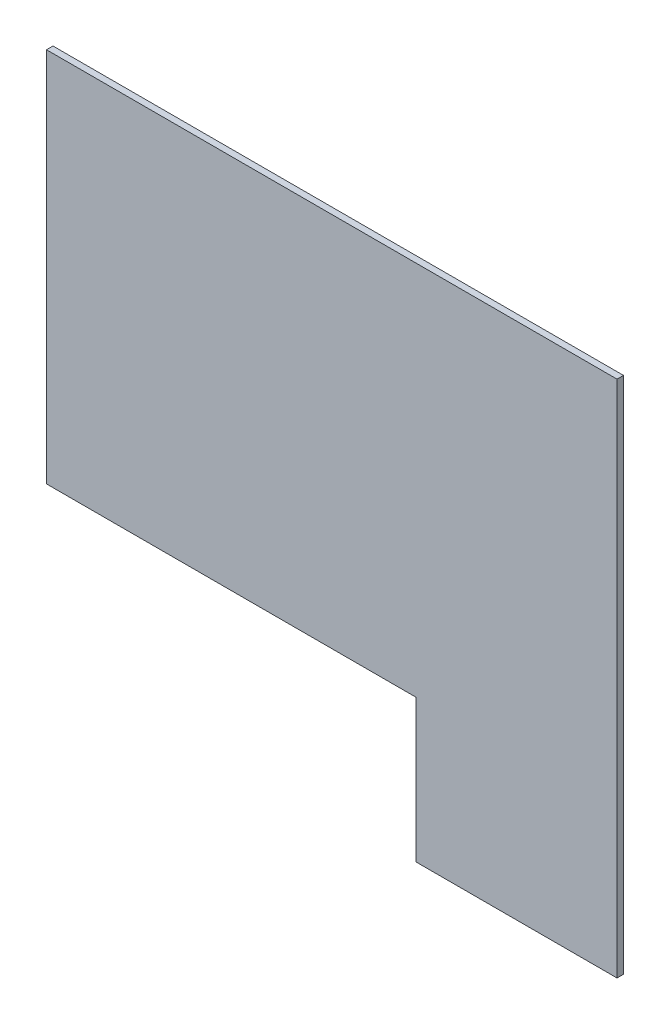
from build123d import *

# Parameters (mm, degrees)
SALIENTE_EXTRUIR1_DEPTH = 5


with BuildPart() as part:
    # Croquis1 → Saliente-Extruir1 (new body)
    with BuildSketch(Plane(origin=(0, 0, 0), x_dir=(-1, 0, 0), z_dir=(0, 0, 1))):
        Polygon((-143.586706802, 402.295789036), (-228.586706802, 402.295789036), (-228.586706802, 2.295789036), (211.413293198, 2.295789036), (211.413293198, 292.295789036), (-73.586706802, 292.295789036), (-73.586706802, 402.295789036), align=None)
    extrude(amount=SALIENTE_EXTRUIR1_DEPTH)


solid = part.part
